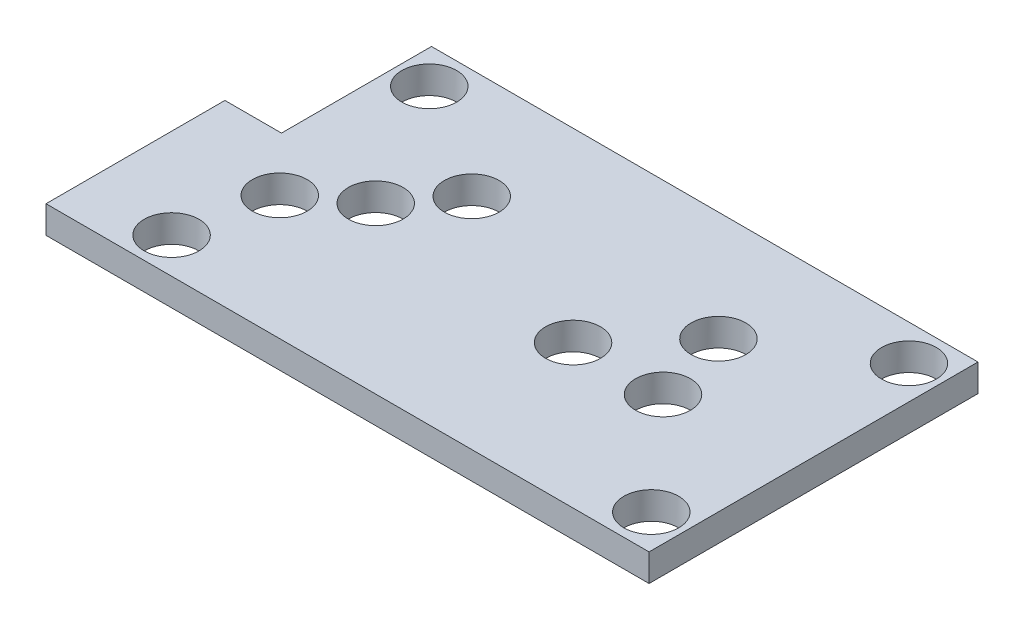
from build123d import *

# Parameters (mm, degrees)
SKETCH1_W           = 220
SKETCH1_H           = 120
BOSS_EXTRUDE1_DEPTH = 10
CUT_EXTRUDE1_REACH  = 127.698
SKETCH2_W           = 20.632503002
SKETCH2_H           = 54.730004003
CUT_EXTRUDE2_REACH  = 127.698
SKETCH3_R           = 10


with BuildPart() as part:
    # Sketch1 → Boss-Extrude1 (new body)
    with BuildSketch(Plane(origin=(0, 0, 0), x_dir=(1, 0, 0), z_dir=(0, 1, 0))):
        Rectangle(SKETCH1_W, SKETCH1_H)
    extrude(amount=-BOSS_EXTRUDE1_DEPTH)

    # Sketch2 → Cut-Extrude1 (cut, up to next)
    with BuildSketch(Plane(origin=(0, 0, 0), x_dir=(1, 0, 0), z_dir=(0, 1, 0)), mode=Mode.PRIVATE) as cut_extrude1_sk1:
        with Locations((-99.683748499, 32.634997999)):
            Rectangle(SKETCH2_W, SKETCH2_H)
    cut_extrude1_tool1 = extrude(cut_extrude1_sk1.sketch, amount=-CUT_EXTRUDE1_REACH, mode=Mode.PRIVATE) & part.part
    add(cut_extrude1_tool1.solids().sort_by_distance((-99.683748, 0, -32.634998))[0], mode=Mode.SUBTRACT)

    # Sketch3 → Cut-Extrude2 (cut, up to next)
    with BuildSketch(Plane(origin=(0, 0, 0), x_dir=(1, 0, 0), z_dir=(0, 1, 0)), mode=Mode.PRIVATE) as cut_extrude2_sk1:
        with Locations(Location((97.816251501, -47, 0), (0, 0, 270))):
            Circle(SKETCH3_R)
    cut_extrude2_tool1 = extrude(cut_extrude2_sk1.sketch, amount=-CUT_EXTRUDE2_REACH, mode=Mode.PRIVATE) & part.part
    # Sketch3 → Cut-Extrude2 (cut, up to next)
    with BuildSketch(Plane(origin=(0, 0, 0), x_dir=(1, 0, 0), z_dir=(0, 1, 0)), mode=Mode.PRIVATE) as cut_extrude2_sk2:
        with Locations(Location((-77.183748499, -47, 0), (0, 0, 270))):
            Circle(SKETCH3_R)
    cut_extrude2_tool2 = extrude(cut_extrude2_sk2.sketch, amount=-CUT_EXTRUDE2_REACH, mode=Mode.PRIVATE) & part.part
    # Sketch3 → Cut-Extrude2 (cut, up to next)
    with BuildSketch(Plane(origin=(0, 0, 0), x_dir=(1, 0, 0), z_dir=(0, 1, 0)), mode=Mode.PRIVATE) as cut_extrude2_sk3:
        with Locations(Location((-70, -14.72, 0), (0, 0, 270))):
            Circle(SKETCH3_R)
    cut_extrude2_tool3 = extrude(cut_extrude2_sk3.sketch, amount=-CUT_EXTRUDE2_REACH, mode=Mode.PRIVATE) & part.part
    # Sketch3 → Cut-Extrude2 (cut, up to next)
    with BuildSketch(Plane(origin=(0, 0, 0), x_dir=(1, 0, 0), z_dir=(0, 1, 0)), mode=Mode.PRIVATE) as cut_extrude2_sk4:
        with Locations(Location((-50, 0.28, 0), (0, 0, 270))):
            Circle(SKETCH3_R)
    cut_extrude2_tool4 = extrude(cut_extrude2_sk4.sketch, amount=-CUT_EXTRUDE2_REACH, mode=Mode.PRIVATE) & part.part
    # Sketch3 → Cut-Extrude2 (cut, up to next)
    with BuildSketch(Plane(origin=(0, 0, 0), x_dir=(1, 0, 0), z_dir=(0, 1, 0)), mode=Mode.PRIVATE) as cut_extrude2_sk5:
        with Locations(Location((30, -7.72, 0), (0, 0, 270))):
            Circle(SKETCH3_R)
    cut_extrude2_tool5 = extrude(cut_extrude2_sk5.sketch, amount=-CUT_EXTRUDE2_REACH, mode=Mode.PRIVATE) & part.part
    # Sketch3 → Cut-Extrude2 (cut, up to next)
    with BuildSketch(Plane(origin=(0, 0, 0), x_dir=(1, 0, 0), z_dir=(0, 1, 0)), mode=Mode.PRIVATE) as cut_extrude2_sk6:
        with Locations(Location((62.816251501, -7.72, 0), (0, 0, 270))):
            Circle(SKETCH3_R)
    cut_extrude2_tool6 = extrude(cut_extrude2_sk6.sketch, amount=-CUT_EXTRUDE2_REACH, mode=Mode.PRIVATE) & part.part
    # Sketch3 → Cut-Extrude2 (cut, up to next)
    with BuildSketch(Plane(origin=(0, 0, 0), x_dir=(1, 0, 0), z_dir=(0, 1, 0)), mode=Mode.PRIVATE) as cut_extrude2_sk7:
        with Locations(Location((55.316251501, 20, 0), (0, 0, 270))):
            Circle(SKETCH3_R)
    cut_extrude2_tool7 = extrude(cut_extrude2_sk7.sketch, amount=-CUT_EXTRUDE2_REACH, mode=Mode.PRIVATE) & part.part
    # Sketch3 → Cut-Extrude2 (cut, up to next)
    with BuildSketch(Plane(origin=(0, 0, 0), x_dir=(1, 0, 0), z_dir=(0, 1, 0)), mode=Mode.PRIVATE) as cut_extrude2_sk8:
        with Locations(Location((97.816251501, 47, 0), (0, 0, 270))):
            Circle(SKETCH3_R)
    cut_extrude2_tool8 = extrude(cut_extrude2_sk8.sketch, amount=-CUT_EXTRUDE2_REACH, mode=Mode.PRIVATE) & part.part
    # Sketch3 → Cut-Extrude2 (cut, up to next)
    with BuildSketch(Plane(origin=(0, 0, 0), x_dir=(1, 0, 0), z_dir=(0, 1, 0)), mode=Mode.PRIVATE) as cut_extrude2_sk9:
        with Locations(Location((-34.683748499, 20, 0), (0, 0, 270))):
            Circle(SKETCH3_R)
    cut_extrude2_tool9 = extrude(cut_extrude2_sk9.sketch, amount=-CUT_EXTRUDE2_REACH, mode=Mode.PRIVATE) & part.part
    # Sketch3 → Cut-Extrude2 (cut, up to next)
    with BuildSketch(Plane(origin=(0, 0, 0), x_dir=(1, 0, 0), z_dir=(0, 1, 0)), mode=Mode.PRIVATE) as cut_extrude2_sk10:
        with Locations(Location((-77.183748499, 47, 0), (0, 0, 270))):
            Circle(SKETCH3_R)
    cut_extrude2_tool10 = extrude(cut_extrude2_sk10.sketch, amount=-CUT_EXTRUDE2_REACH, mode=Mode.PRIVATE) & part.part
    add(cut_extrude2_tool1.solids().sort_by_distance((97.816252, 0, 47))[0], mode=Mode.SUBTRACT)
    add(cut_extrude2_tool2.solids().sort_by_distance((-77.183748, 0, 47))[0], mode=Mode.SUBTRACT)
    add(cut_extrude2_tool3.solids().sort_by_distance((-70, 0, 14.72))[0], mode=Mode.SUBTRACT)
    add(cut_extrude2_tool4.solids().sort_by_distance((-50, 0, -0.28))[0], mode=Mode.SUBTRACT)
    add(cut_extrude2_tool5.solids().sort_by_distance((30, 0, 7.72))[0], mode=Mode.SUBTRACT)
    add(cut_extrude2_tool6.solids().sort_by_distance((62.816252, 0, 7.72))[0], mode=Mode.SUBTRACT)
    add(cut_extrude2_tool7.solids().sort_by_distance((55.316252, 0, -20))[0], mode=Mode.SUBTRACT)
    add(cut_extrude2_tool8.solids().sort_by_distance((97.816252, 0, -47))[0], mode=Mode.SUBTRACT)
    add(cut_extrude2_tool9.solids().sort_by_distance((-34.683748, 0, -20))[0], mode=Mode.SUBTRACT)
    add(cut_extrude2_tool10.solids().sort_by_distance((-77.183748, 0, -47))[0], mode=Mode.SUBTRACT)


solid = part.part
